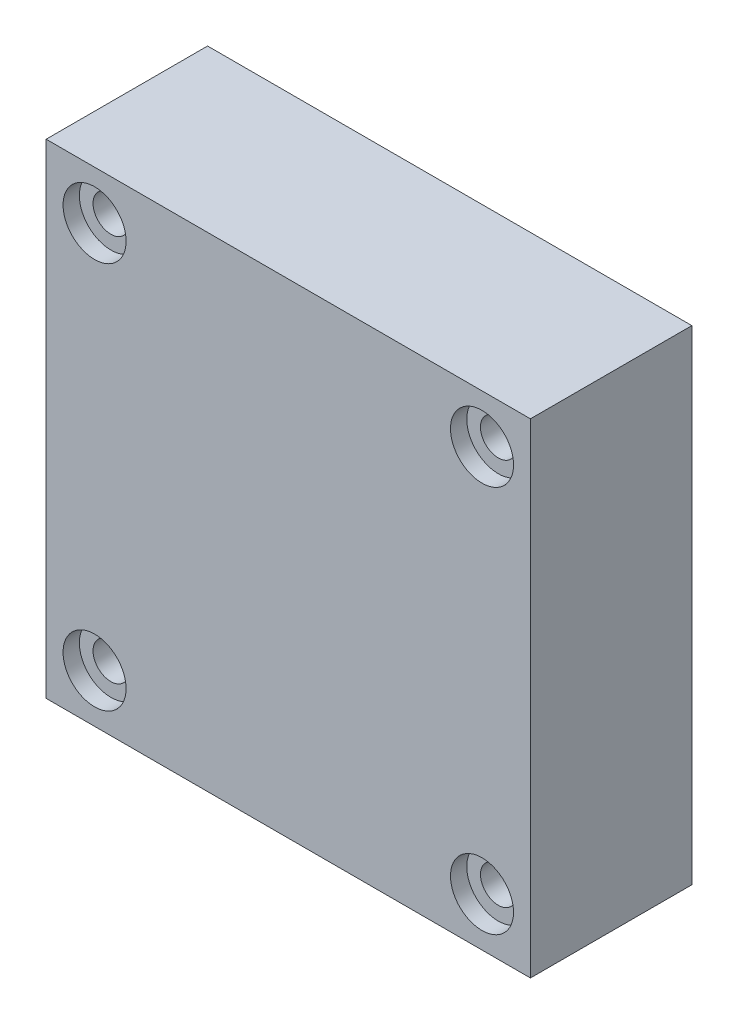
from build123d import *

# Parameters (mm, degrees)
SKETCH2_W                                       = 76.2
SKETCH2_H                                       = 76.2
BOSS_EXTRUDE1_DEPTH                             = 25.4
CBORE_FOR_10_BUTTON_HEAD_CAP_SCREW1_D           = 5.6134
CBORE_FOR_10_BUTTON_HEAD_CAP_SCREW1_CBORE_D     = 9.92124
CBORE_FOR_10_BUTTON_HEAD_CAP_SCREW1_CBORE_DEPTH = 2.5654


with BuildPart() as part:
    # Sketch2 → Boss-Extrude1 (new body)
    with BuildSketch(Plane.XY):
        with Locations((38.1, 38.1)):
            Rectangle(SKETCH2_W, SKETCH2_H)
    extrude(amount=BOSS_EXTRUDE1_DEPTH)

    # CBORE for #10 Button Head Cap Screw1 (through all)
    with Locations(Plane.XY.offset(25.4)):
        with Locations((7.62, 68.58), (68.58, 68.58), (68.58, 7.62), (7.62, 7.62)):
            CounterBoreHole(CBORE_FOR_10_BUTTON_HEAD_CAP_SCREW1_D / 2, CBORE_FOR_10_BUTTON_HEAD_CAP_SCREW1_CBORE_D / 2, CBORE_FOR_10_BUTTON_HEAD_CAP_SCREW1_CBORE_DEPTH)


solid = part.part
